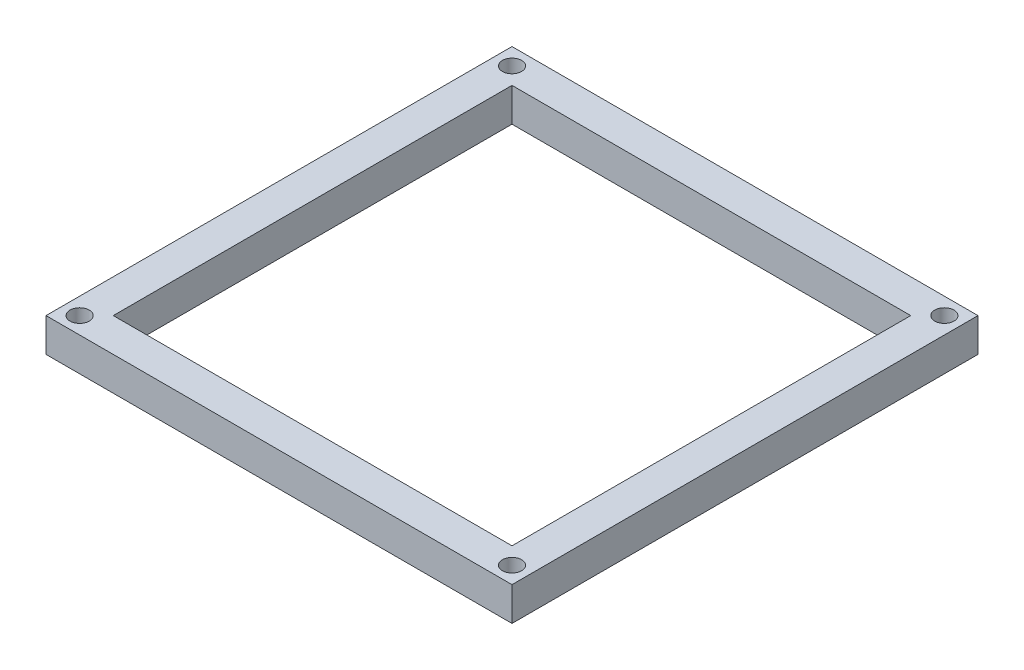
from build123d import *

# Parameters (mm, degrees)
SKETCH1_W           = 97
SKETCH1_H           = 97
BOSS_EXTRUDE1_DEPTH = 7
SKETCH2_W           = 83
SKETCH2_H           = 83
CUT_EXTRUDE1_DEPTH  = 7
SKETCH3_R           = 2
CUT_EXTRUDE2_DEPTH  = 10


with BuildPart() as part:
    # Sketch1 → Boss-Extrude1 (new body)
    with BuildSketch(Plane(origin=(0, 0, 0), x_dir=(1, 0, 0), z_dir=(0, 1, 0))):
        with Locations((48.5, 48.5)):
            Rectangle(SKETCH1_W, SKETCH1_H)
    extrude(amount=BOSS_EXTRUDE1_DEPTH)

    # Sketch2 → Cut-Extrude1 (cut)
    with BuildSketch(Plane(origin=(0, 7, 0), x_dir=(1, 0, 0), z_dir=(0, 1, 0))):
        with Locations((48.5, 48.5)):
            Rectangle(SKETCH2_W, SKETCH2_H)
    extrude(amount=-CUT_EXTRUDE1_DEPTH, mode=Mode.SUBTRACT)

    # Sketch3 → Cut-Extrude2 (cut)
    with BuildSketch(Plane(origin=(0, 7, 0), x_dir=(1, 0, 0), z_dir=(0, 1, 0))):
        with Locations(Location((3.5, 93.5, 0), (0, 0, 270))):
            Circle(SKETCH3_R)
        with Locations(Location((93.5, 3.5, 0), (0, 0, 270))):
            Circle(SKETCH3_R)
        with Locations(Location((3.5, 3.5, 0), (0, 0, 270))):
            Circle(SKETCH3_R)
        with Locations(Location((93.5, 93.5, 0), (0, 0, 270))):
            Circle(SKETCH3_R)
    extrude(amount=-CUT_EXTRUDE2_DEPTH, mode=Mode.SUBTRACT)


solid = part.part
